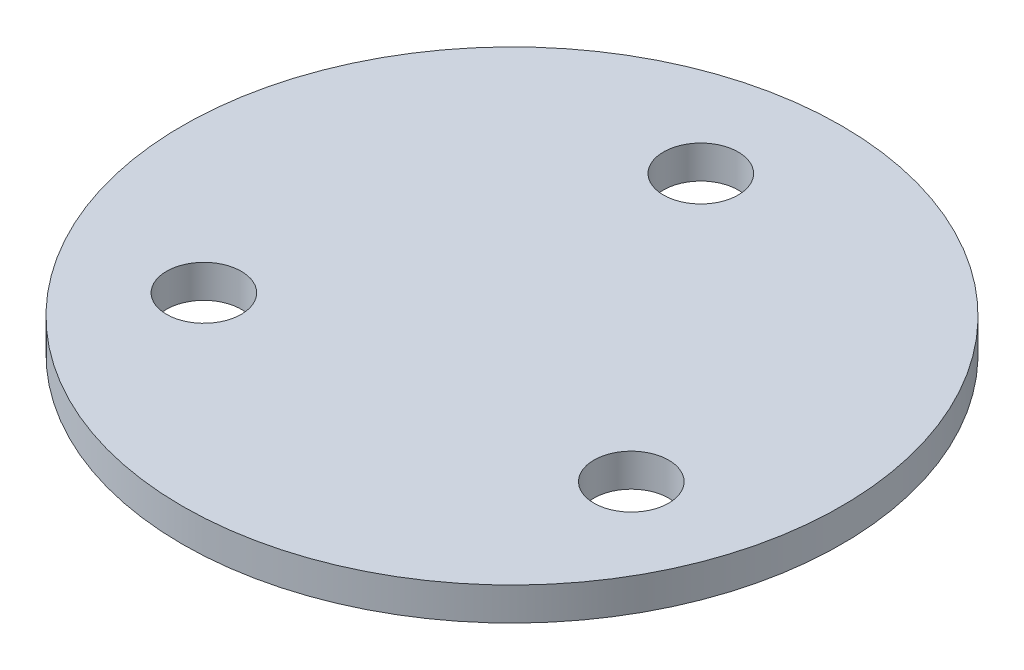
from build123d import *

# Parameters (mm, degrees)
SKETCH1_R           = 15
SKETCH1_R_2         = 1.7
BOSS_EXTRUDE1_DEPTH = 1.5


with BuildPart() as part:
    # Sketch1 → Boss-Extrude1 (new body)
    with BuildSketch(Plane(origin=(0, 0, 0), x_dir=(1, 0, 0), z_dir=(0, 1, 0))):
        with Locations(Location((0, 0, 0), (0, 0, 270))):
            Circle(SKETCH1_R)
        with Locations(Location((9.243977276, -3.814299953, 0), (0, 0, 270))):
            Circle(SKETCH1_R_2, mode=Mode.SUBTRACT)
        with Locations(Location((-7.925269294, -6.098369176, 0), (0, 0, 270))):
            Circle(SKETCH1_R_2, mode=Mode.SUBTRACT)
        with Locations(Location((-1.318707981, 9.912669129, 0), (0, 0, 270))):
            Circle(SKETCH1_R_2, mode=Mode.SUBTRACT)
    extrude(amount=BOSS_EXTRUDE1_DEPTH)


solid = part.part
